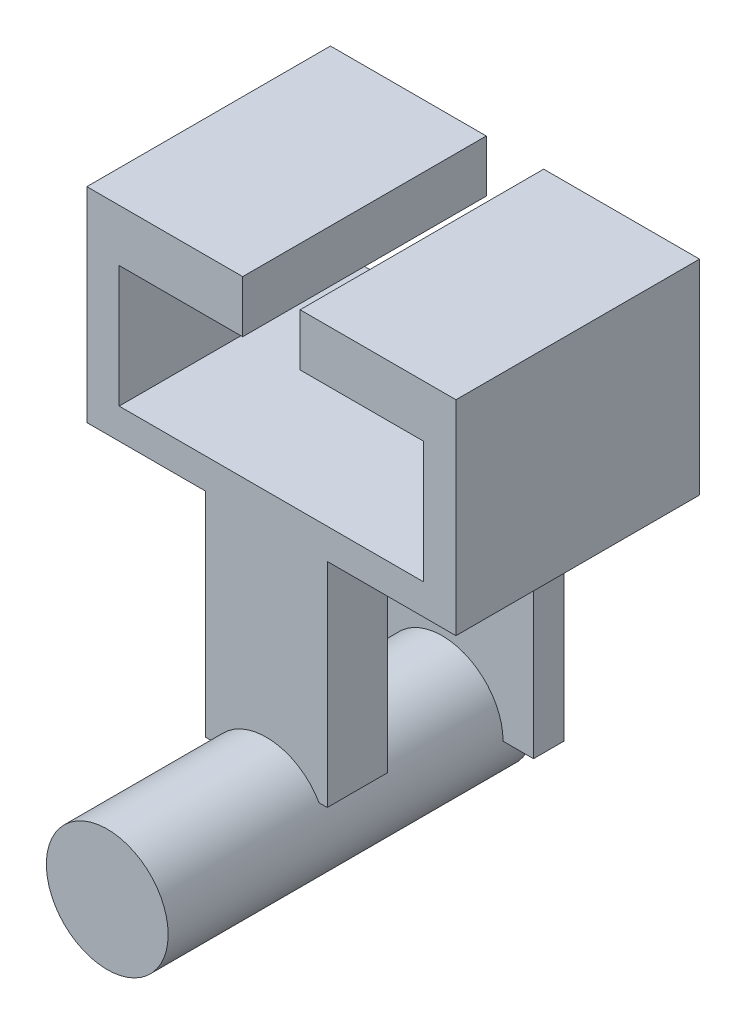
from build123d import *

# Parameters (mm, degrees)
SKETCH3_R            = 12.7
BOSS_EXTRUDE1_DEPTH  = 76.2
BOSS_EXTRUDE2_DEPTH  = 6.35
SKETCH6_W            = 63.5
SKETCH6_H            = 50.8
BOSS_EXTRUDE3_DEPTH  = 6.35
SKETCH9_W            = 50.8
SKETCH9_H            = 6.35
BOSS_EXTRUDE4_DEPTH  = 0.38862
SKETCH10_W           = 0.38862
SKETCH10_H           = 50.8
BOSS_EXTRUDE5_DEPTH  = 25.4
SKETCH11_W           = 50.8
SKETCH11_H           = 6.35
BOSS_EXTRUDE6_DEPTH  = 0.38862
SKETCH13_W           = 0.38862
SKETCH13_H           = 50.8
BOSS_EXTRUDE7_DEPTH  = 25.4
SKETCH14_W           = 0.38862
SKETCH14_H           = 50.8
BOSS_EXTRUDE8_DEPTH  = 10.8712
SKETCH15_W           = 50.8
SKETCH15_H           = 10.8712
BOSS_EXTRUDE9_DEPTH  = 25.76322
SKETCH16_W           = 0.38862
SKETCH16_H           = 50.8
BOSS_EXTRUDE10_DEPTH = 10.8712
SKETCH17_W           = 50.8
SKETCH17_H           = 10.8712
BOSS_EXTRUDE11_DEPTH = 25.76322
RIB4_REACH           = 127.041
SKETCH21_WALL_W      = 279.8678728
SKETCH21_WALL_H      = 25.4
RIB15_REACH          = 127.041
SKETCH22_WALL_W      = 278.64922185
SKETCH22_WALL_H      = 25.4
SKETCH26_W           = 25.4
SKETCH26_H           = 12.600318116
BOSS_EXTRUDE12_DEPTH = 44.45
SKETCH27_W           = 50.8
SKETCH27_H           = 42.6212
BOSS_EXTRUDE13_DEPTH = 6.35
SKETCH28_W           = 50.8
SKETCH28_H           = 42.6212
BOSS_EXTRUDE14_DEPTH = 6.35


with BuildPart() as part:
    # Sketch3 → Boss-Extrude1 (new body)
    with BuildSketch(Plane.XY):
        with Locations(Location((0, 0, 0), (0, 0, 180))):
            Circle(SKETCH3_R)
    extrude(amount=BOSS_EXTRUDE1_DEPTH)

    # Sketch4 → Boss-Extrude2 (add)
    with BuildSketch(Plane(origin=(0, 0, 0), x_dir=(-1, 0, 0), z_dir=(0, 0, -1))):
        Polygon((0, 0), (19.05, 0), (19.05, 50.8), (-19.05, 50.8), (-19.05, 0), align=None)
    extrude(amount=-BOSS_EXTRUDE2_DEPTH)

    # Sketch6 → Boss-Extrude3 (add)
    with BuildSketch(Plane(origin=(0, 50.8, 0), x_dir=(1, 0, 0), z_dir=(0, 1, 0))):
        with Locations((1.04805825, -17.613482739)):
            Rectangle(SKETCH6_W, SKETCH6_H)
    extrude(amount=BOSS_EXTRUDE3_DEPTH)

    # Sketch9 → Boss-Extrude4 (add)
    with BuildSketch(Plane(origin=(32.79805825, 0, 0), x_dir=(0, 0, -1), z_dir=(1, 0, 0))):
        with Locations((-17.613482739, 53.975)):
            Rectangle(SKETCH9_W, SKETCH9_H)
    extrude(amount=BOSS_EXTRUDE4_DEPTH)

    # Sketch10 → Boss-Extrude5 (add)
    with BuildSketch(Plane(origin=(0, 57.15, 0), x_dir=(1, 0, 0), z_dir=(0, 1, 0))):
        with Locations((32.99236825, -17.613482739)):
            Rectangle(SKETCH10_W, SKETCH10_H)
    extrude(amount=BOSS_EXTRUDE5_DEPTH)

    # Sketch11 → Boss-Extrude6 (add)
    with BuildSketch(Plane.ZY.offset(30.70194175)):
        with Locations((17.613482739, 53.975)):
            Rectangle(SKETCH11_W, SKETCH11_H)
    extrude(amount=BOSS_EXTRUDE6_DEPTH)

    # Sketch13 → Boss-Extrude7 (add)
    with BuildSketch(Plane(origin=(0, 57.15, 0), x_dir=(1, 0, 0), z_dir=(0, 1, 0))):
        with Locations((-30.89625175, -17.613482739)):
            Rectangle(SKETCH13_W, SKETCH13_H)
    extrude(amount=BOSS_EXTRUDE7_DEPTH)

    # Sketch14 → Boss-Extrude8 (add)
    with BuildSketch(Plane(origin=(0, 82.55, 0), x_dir=(1, 0, 0), z_dir=(0, 1, 0))):
        with Locations((-30.89625175, -17.613482739)):
            Rectangle(SKETCH14_W, SKETCH14_H)
    extrude(amount=BOSS_EXTRUDE8_DEPTH)

    # Sketch15 → Boss-Extrude9 (add)
    with BuildSketch(Plane(origin=(-30.70194175, 0, 0), x_dir=(0, 0, -1), z_dir=(1, 0, 0))):
        with Locations((-17.613482739, 87.9856)):
            Rectangle(SKETCH15_W, SKETCH15_H)
    extrude(amount=BOSS_EXTRUDE9_DEPTH)

    # Sketch16 → Boss-Extrude10 (add)
    with BuildSketch(Plane(origin=(0, 82.55, 0), x_dir=(1, 0, 0), z_dir=(0, 1, 0))):
        with Locations((32.99236825, -17.613482739)):
            Rectangle(SKETCH16_W, SKETCH16_H)
    extrude(amount=BOSS_EXTRUDE10_DEPTH)

    # Sketch17 → Boss-Extrude11 (add)
    with BuildSketch(Plane.ZY.offset(-32.79805825)):
        with Locations((17.613482739, 87.9856)):
            Rectangle(SKETCH17_W, SKETCH17_H)
    extrude(amount=BOSS_EXTRUDE11_DEPTH)

    # Sketch21 wall → Rib4 (add, up to next)
    with BuildSketch(Plane(origin=(0, 38.1, 11.981741369), x_dir=(0, 0.914150584151, 0.405374776592), z_dir=(0, -0.405374776592, 0.914150584151)), mode=Mode.PRIVATE) as rib4_sk1:
        Rectangle(SKETCH21_WALL_W, SKETCH21_WALL_H)
    rib4_tool1 = extrude(rib4_sk1.sketch, amount=-RIB4_REACH, mode=Mode.PRIVATE) - part.part
    add(rib4_tool1.solids().sort_by_distance((0, 38.1, 11.981741369))[0])

    # Sketch22 wall → Rib15 (add, up to next)
    with BuildSketch(Plane(origin=(0, 38.1, -3.893258631), x_dir=(0, 0.956083915685, -0.293093067419), z_dir=(0, 0.293093067419, 0.956083915685)), mode=Mode.PRIVATE) as rib15_sk1:
        Rectangle(SKETCH22_WALL_W, SKETCH22_WALL_H)
    rib15_tool1 = extrude(rib15_sk1.sketch, amount=RIB15_REACH, mode=Mode.PRIVATE) - part.part
    add(rib15_tool1.solids().sort_by_distance((0, 38.1, -3.893258631))[0])

    # Sketch26 → Boss-Extrude12 (add)
    with BuildSketch(Plane(origin=(0, 50.8, 0), x_dir=(-1, 0, 0), z_dir=(0, -1, 0))):
        with Locations((0, -36.713323681)):
            Rectangle(SKETCH26_W, SKETCH26_H)
    extrude(amount=BOSS_EXTRUDE12_DEPTH)

    # Sketch27 → Boss-Extrude13 (add)
    with BuildSketch(Plane(origin=(33.18667825, 0, 0), x_dir=(0, 0, -1), z_dir=(1, 0, 0))):
        with Locations((-17.613482739, 72.1106)):
            Rectangle(SKETCH27_W, SKETCH27_H)
    extrude(amount=BOSS_EXTRUDE13_DEPTH)

    # Sketch28 → Boss-Extrude14 (add)
    with BuildSketch(Plane.ZY.offset(31.09056175)):
        with Locations((17.613482739, 72.1106)):
            Rectangle(SKETCH28_W, SKETCH28_H)
    extrude(amount=BOSS_EXTRUDE14_DEPTH)


solid = part.part
